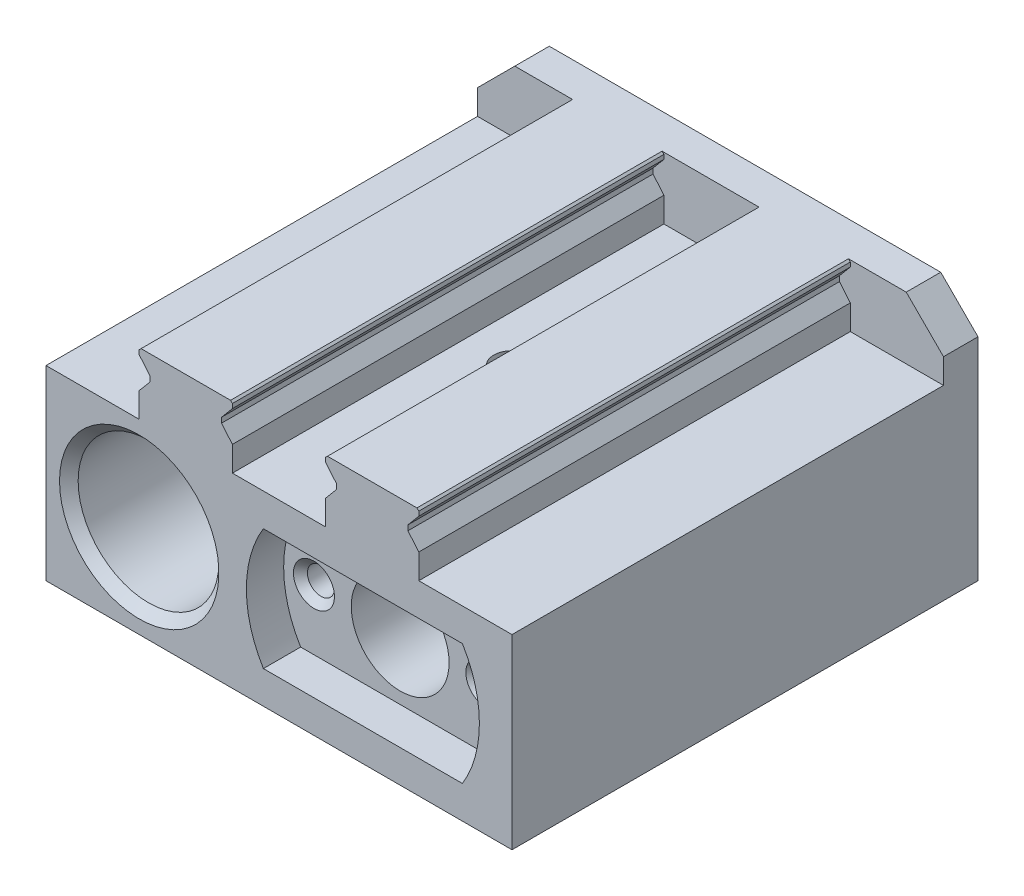
from build123d import *

# Parameters (mm, degrees)
SKICA4_W                  = 50
SKICA4_H                  = 50
P_IDAT_VYSUNUT_M2_DEPTH   = 20
ODEBRAT_VYSUNUT_M3_DEPTH  = 3.5
SKICA6_R                  = 1.45
ODEBRAT_VYSUNUT_M4_DEPTH  = 14
SKICA7_R                  = 5.25
ODEBRAT_VYSUNUT_M5_DEPTH  = 57.455734873
SKICA8_R                  = 7.55
ODEBRAT_VYSUNUT_M6_DEPTH  = 60.371710435
P_IDAT_VYSUNUT_M4_DEPTH   = 50
SKICA12_R                 = 1.95
ODEBRAT_VYSUNUT_M7_DEPTH  = 41.620192023
SKICA13_R                 = 4
ODEBRAT_VYSUNUT_M8_DEPTH  = 6
P_IDAT_VYSUNUT_M5_REACH   = 63.938
SKICA14_W                 = 3.7
SKICA14_H                 = 6.67
ZKOSEN_1_SIZE             = 1
ODEBRAT_VYSUNUT_M9_DEPTH  = 2
ODEBRAT_VYSUNUT_M10_DEPTH = 0.5
ZKOSEN_2_SIZE             = 0.75
ZKOSEN_3_SIZE             = 4


with BuildPart() as part:
    # Skica4 → Přidat vysunutím2 (new body)
    with BuildSketch(Plane(origin=(0, 0, 0), x_dir=(1, 0, 0), z_dir=(0, 1, 0))):
        Rectangle(SKICA4_W, SKICA4_H)
    extrude(amount=P_IDAT_VYSUNUT_M2_DEPTH)

    # Skica5 → Odebrat vysunutím3 (cut)
    with BuildSketch(Plane.XY.offset(25)):
        with BuildLine():
            Line((-1.677078252, 16.5), (19.677078252, 16.5))
            ThreePointArc((19.677078252, 16.5), (21.5, 10), (19.677078252, 3.5))
            Line((19.677078252, 3.5), (-1.677078252, 3.5))
            ThreePointArc((-1.677078252, 3.5), (-3.5, 10), (-1.677078252, 16.5))
        make_face()
    odebrat_vysunut_m3 = extrude(amount=-ODEBRAT_VYSUNUT_M3_DEPTH, mode=Mode.SUBTRACT)

    # Skica6 → Odebrat vysunutím4 (cut)
    with BuildSketch(Plane.XY.offset(21.5)):
        with Locations((-0.25, 10)):
            Circle(SKICA6_R)
        with Locations((18.25, 10)):
            Circle(SKICA6_R)
    odebrat_vysunut_m4 = extrude(amount=-ODEBRAT_VYSUNUT_M4_DEPTH, mode=Mode.SUBTRACT)

    # Zrcadlit1: Odebrat vysunutím3, Odebrat vysunutím4 across plane
    add(odebrat_vysunut_m3.mirror(Plane.XY), mode=Mode.SUBTRACT)
    add(odebrat_vysunut_m4.mirror(Plane.XY), mode=Mode.SUBTRACT)

    # Skica7 → Odebrat vysunutím5 (cut, through all)
    with BuildSketch(Plane.XY.offset(21.5)):
        with Locations((9, 10)):
            Circle(SKICA7_R)
    extrude(amount=-ODEBRAT_VYSUNUT_M5_DEPTH, mode=Mode.SUBTRACT)

    # Skica8 → Odebrat vysunutím6 (cut, through all)
    with BuildSketch(Plane.XY.offset(25)):
        with Locations((-15, 10)):
            Circle(SKICA8_R)
    extrude(amount=-ODEBRAT_VYSUNUT_M6_DEPTH, mode=Mode.SUBTRACT)

    # Skica11 → Přidat vysunutím4 (add)
    with BuildSketch(Plane(origin=(0, 0, -25), x_dir=(-1, 0, 0), z_dir=(0, 0, -1))):
        Polygon((-15, 20), (-15, 22.67), (-13.833651513, 24.06), (-13.833651513, 24.61), (-15, 26), (-15, 26.47), (-14.8, 26.67), (-5.2, 26.67), (-5, 26.47), (-5, 26), (-6.166348487, 24.61), (-6.166348487, 24.06), (-5, 22.67), (-5, 20), align=None)
        Polygon((15, 20), (15, 22.67), (13.833651513, 24.06), (13.833651513, 24.61), (15, 26), (15, 26.47), (14.8, 26.67), (5.2, 26.67), (5, 26.47), (5, 26), (6.166348487, 24.61), (6.166348487, 24.06), (5, 22.67), (5, 20), align=None)
    extrude(amount=-P_IDAT_VYSUNUT_M4_DEPTH)

    # Skica12 → Odebrat vysunutím7 (cut, through all)
    with BuildSketch(Plane(origin=(0, 20, 0), x_dir=(1, 0, 0), z_dir=(0, 1, 0))):
        with Locations(Location((0, 0, 0), (0, 0, 270))):
            Circle(SKICA12_R)
    extrude(amount=-ODEBRAT_VYSUNUT_M7_DEPTH, mode=Mode.SUBTRACT)

    # Skica13 → Odebrat vysunutím8 (cut)
    with BuildSketch(Plane.XZ):
        with Locations(Location((0, 0, 0), (0, 0, 270))):
            Circle(SKICA13_R)
    extrude(amount=-ODEBRAT_VYSUNUT_M8_DEPTH, mode=Mode.SUBTRACT)

    # Přidat vysunutím5: up to this face of the body (flat: up to its plane)
    p_idat_vysunut_m5_end = Plane(part.part.faces().sort_by_distance((-25, 10, 0))[0])
    # Skica14 → Přidat vysunutím5 (add, up to the picked face)
    with BuildSketch(Plane(origin=(25, 0, 0), x_dir=(0, 0, -1), z_dir=(1, 0, 0)), mode=Mode.PRIVATE) as p_idat_vysunut_m5_sk1:
        with Locations((23.15, 23.335)):
            Rectangle(SKICA14_W, SKICA14_H)
    p_idat_vysunut_m5_tool1 = split(extrude(p_idat_vysunut_m5_sk1.sketch, amount=-P_IDAT_VYSUNUT_M5_REACH, mode=Mode.PRIVATE), bisect_by=p_idat_vysunut_m5_end, keep=Keep.BOTH, mode=Mode.PRIVATE)
    add(p_idat_vysunut_m5_tool1.solids().sort_by(Axis((25, 23.335, -23.15), (-1, 0, 0)))[0])

    # Zkosení1
    zkosen_1_edges = [part.edges().sort_by_distance(p)[0] for p in [
        (-22.55, 10, 25),
    ]]
    chamfer(zkosen_1_edges, length=ZKOSEN_1_SIZE)

    # Skica16 → Odebrat vysunutím9 (cut)
    with BuildSketch(Plane(origin=(0, 0, -21.5), x_dir=(-1, 0, 0), z_dir=(0, 0, -1))):
        with BuildLine():
            Line((1.677078252, 16.5), (-19.677078252, 16.5))
            ThreePointArc((-19.677078252, 16.5), (-21.5, 10), (-19.677078252, 3.5))
            Line((-19.677078252, 3.5), (1.677078252, 3.5))
            ThreePointArc((1.677078252, 3.5), (3.5, 10), (1.677078252, 16.5))
        make_face()
    extrude(amount=-ODEBRAT_VYSUNUT_M9_DEPTH, mode=Mode.SUBTRACT)

    # Skica17 → Odebrat vysunutím10 (cut)
    with BuildSketch(Plane.XY.offset(21.5)):
        with BuildLine():
            Line((-1.677078252, 3.5), (19.677078252, 3.5))
            ThreePointArc((19.677078252, 3.5), (21.5, 10), (19.677078252, 16.5))
            Line((19.677078252, 16.5), (-1.677078252, 16.5))
            ThreePointArc((-1.677078252, 16.5), (-3.5, 10), (-1.677078252, 3.5))
        make_face()
    extrude(amount=-ODEBRAT_VYSUNUT_M10_DEPTH, mode=Mode.SUBTRACT)

    # Zkosení2
    zkosen_2_edges = [part.edges().sort_by_distance(p)[0] for p in [
        (16.8, 10, -19.5),
        (-1.7, 10, -19.5),
        (16.8, 10, 21),
        (-1.7, 10, 21),
    ]]
    chamfer(zkosen_2_edges, length=ZKOSEN_2_SIZE)

    # Zkosení3
    zkosen_3_edges = [part.edges().sort_by_distance(p)[0] for p in [
        (25, 26.67, -23.15),
        (-25, 26.67, -23.15),
    ]]
    chamfer(zkosen_3_edges, length=ZKOSEN_3_SIZE)


solid = part.part
